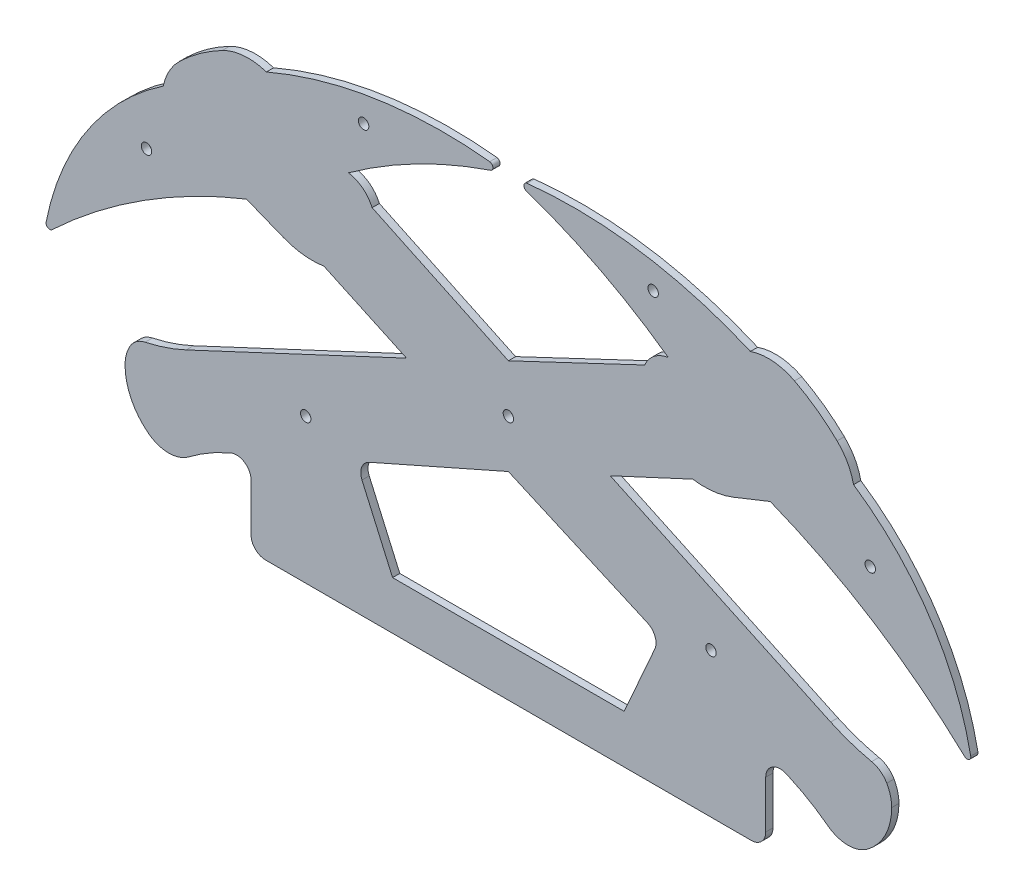
from build123d import *

# Parameters (mm, degrees)
BOSS_EXTRUDE1_DEPTH = 3.175
BOSS_EXTRUDE2_DEPTH = 3.175
FILLET1_R           = 6.35
SKETCH3_R           = 2.286
CUT_EXTRUDE1_DEPTH  = 518.046822543
FILLET2_R           = 1.5875
SCALE4_SCALE        = 0.9


with BuildPart() as part:
    # Sketch1 → Boss-Extrude1 (new body)
    with BuildSketch(Plane.XY):
        with BuildLine():
            Line((192.983759728, 175.441215803), (96.309561297, 130.227436844))
            ThreePointArc((96.309561297, 130.227436844), (87.484677999, 126.692854878), (78.317465574, 124.176100766))
            ThreePointArc((78.317465574, 124.176100766), (74.466708454, 122.444126875), (71.664680309, 119.285535064))
            ThreePointArc((71.664680309, 119.285535064), (70.058699462, 115.330377605), (69.512486748, 111.096691661))
            ThreePointArc((69.512486748, 111.096691661), (72.264254662, 99.39829615), (79.935173725, 90.147259184))
            ThreePointArc((79.935173725, 90.147259184), (88.679137799, 87.2113543), (97.423101873, 90.147259184))
            ThreePointArc((97.423101873, 90.147259184), (105.809954176, 95.76246485), (114.789367372, 100.371148488))
            Line((114.789367372, 100.371148488), (237.663968602, 154.698817321))
            Line((237.663968602, 154.698817321), (360.538569833, 100.371148488))
            ThreePointArc((360.538569833, 100.371148488), (369.517983029, 95.76246485), (377.904835332, 90.147259184))
            ThreePointArc((377.904835332, 90.147259184), (386.648799405, 87.2113543), (395.392763479, 90.147259184))
            ThreePointArc((395.392763479, 90.147259184), (403.063682542, 99.39829615), (405.815450457, 111.096691661))
            ThreePointArc((405.815450457, 111.096691661), (405.269237742, 115.330377605), (403.663256896, 119.285535064))
            ThreePointArc((403.663256896, 119.285535064), (400.86122875, 122.444126875), (397.01047163, 124.176100766))
            ThreePointArc((397.01047163, 124.176100766), (387.843259205, 126.692854878), (379.018375907, 130.227436844))
            Line((379.018375907, 130.227436844), (282.344177476, 175.441215803))
            Line((282.344177476, 175.441215803), (318.55970852, 192.243538611))
            ThreePointArc((318.55970852, 192.243538611), (327.615304884, 192.094216272), (336.396188974, 194.312818822))
            Line((336.396188974, 194.312818822), (352.546314681, 200.753440043))
            ThreePointArc((352.546314681, 200.753440043), (399.763650832, 176.34843342), (441.305300897, 143.191646915))
            ThreePointArc((441.305300897, 143.191646915), (423.803151272, 189.77617727), (389.079447428, 225.423170147))
            ThreePointArc((389.079447428, 225.423170147), (386.452648862, 232.479391977), (381.864833782, 238.449508393))
            ThreePointArc((381.864833782, 238.449508393), (373.00378877, 245.841981415), (363.187253088, 251.908479853))
            ThreePointArc((363.187253088, 251.908479853), (353.665803765, 254.648371797), (343.834991341, 253.415435392))
            ThreePointArc((343.834991341, 253.415435392), (292.266671735, 267.690958579), (238.759580195, 267.420211094))
            ThreePointArc((238.759580195, 267.420211094), (274.672718132, 253.0886387), (307.794144835, 233.135730718))
            ThreePointArc((307.794144835, 233.135730718), (301.585446406, 230.415438718), (297.431026809, 225.059253268))
            Line((297.431026809, 225.059253268), (237.663968602, 196.776891326))
            Line((237.663968602, 196.776891326), (177.896910395, 225.059253268))
            ThreePointArc((177.896910395, 225.059253268), (173.742490798, 230.415438718), (167.533792369, 233.135730718))
            ThreePointArc((167.533792369, 233.135730718), (200.655219072, 253.0886387), (236.568357009, 267.420211094))
            ThreePointArc((236.568357009, 267.420211094), (183.061265469, 267.690958579), (131.492945863, 253.415435392))
            ThreePointArc((131.492945863, 253.415435392), (121.66213344, 254.648371797), (112.140684116, 251.908479853))
            ThreePointArc((112.140684116, 251.908479853), (102.324148434, 245.841981415), (93.463103422, 238.449508393))
            ThreePointArc((93.463103422, 238.449508393), (88.875288342, 232.479391977), (86.248489776, 225.423170147))
            ThreePointArc((86.248489776, 225.423170147), (51.524785932, 189.77617727), (34.022636308, 143.191646915))
            ThreePointArc((34.022636308, 143.191646915), (75.564286372, 176.34843342), (122.781622523, 200.753440043))
            Line((122.781622523, 200.753440043), (138.931748231, 194.312818822))
            ThreePointArc((138.931748231, 194.312818822), (147.712632321, 192.094216272), (156.768228685, 192.243538611))
            Line((156.768228685, 192.243538611), (192.983759728, 175.441215803))
        make_face()
    extrude(amount=BOSS_EXTRUDE1_DEPTH)

    # Sketch2 → Boss-Extrude2 (add)
    with BuildSketch(Plane.XY):
        Polygon((124.775079826, 104.786222668), (124.775079826, 67.83365331), (350.552857378, 67.83365331), (350.552857378, 104.786222668), (304.455055516, 125.167864508), (288.463968602, 89.00031913), (186.863968602, 89.00031913), (170.872881688, 125.167864508), align=None)
    extrude(amount=BOSS_EXTRUDE2_DEPTH)

    # Fillet1
    fillet1_edges = [part.edges().sort_by_distance(p)[0] for p in [
        (304.455055516, 125.167864508, 1.5875),
        (350.552857378, 104.786222668, 1.5875),
        (350.552857378, 67.83365331, 1.5875),
        (124.775079826, 67.83365331, 1.5875),
        (124.775079826, 104.786222668, 1.5875),
        (170.872881688, 125.167864508, 1.5875),
    ]]
    fillet(fillet1_edges, radius=FILLET1_R)

    # Sketch3 → Cut-Extrude1 (cut, through all)
    with BuildSketch(Plane.XY.offset(3.175)):
        with Locations((237.663968602, 175.737854324)):
            Circle(SKETCH3_R)
        with Locations((78.913968602, 197.962854324)):
            Circle(SKETCH3_R)
        with Locations((174.163968602, 255.112854324)):
            Circle(SKETCH3_R)
        with Locations((301.163968602, 255.112854324)):
            Circle(SKETCH3_R)
        with Locations((396.413968602, 197.962854324)):
            Circle(SKETCH3_R)
        with Locations((148.763968602, 131.287854324)):
            Circle(SKETCH3_R)
        with Locations((326.563968602, 131.287854324)):
            Circle(SKETCH3_R)
    extrude(amount=-CUT_EXTRUDE1_DEPTH, mode=Mode.SUBTRACT)

    # Fillet2
    fillet2_edges = [part.edges().sort_by_distance(p)[0] for p in [
        (34.022636308, 143.191646915, 1.5875),
        (236.568357009, 267.420211094, 1.5875),
        (238.759580195, 267.420211094, 1.5875),
        (441.305300897, 143.191646915, 1.5875),
    ]]
    fillet(fillet2_edges, radius=FILLET2_R)


with BuildPart() as part_1:
    # Scale4: scaled about (237.663968386, 165.877309559, 1.5875)
    add(part.part.scale(SCALE4_SCALE).moved(Location((23.766396839, 16.587730956, 0.15875))))


solid = part_1.part
